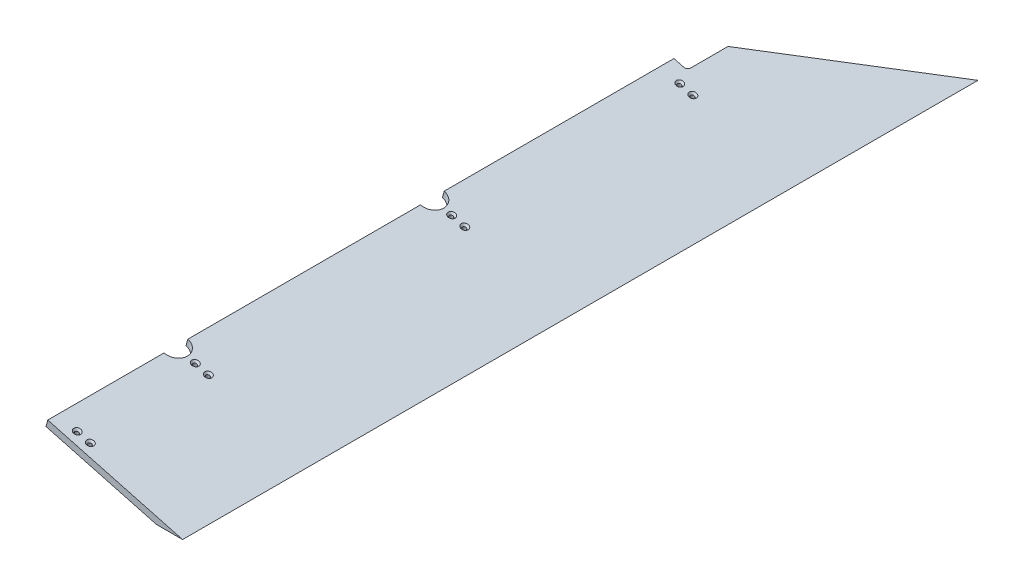
from build123d import *

# Parameters (mm, degrees)
BOSS_EXTRUDE1_DEPTH                                 = 1492.25
CSK_FOR_1_4_FLAT_HEAD_SOCKET_CAP_SCREW1_D           = 7.14248
CSK_FOR_1_4_FLAT_HEAD_SOCKET_CAP_SCREW1_CSINK_D     = 13.4874
CSK_FOR_1_4_FLAT_HEAD_SOCKET_CAP_SCREW1_CSINK_ANGLE = 82
SKETCH4_R                                           = 22.225
CUT_EXTRUDE1_DEPTH                                  = 1517.292738265
CUT_EXTRUDE2_DEPTH                                  = 1517.292738265
FILLET1_R                                           = 6.35


with BuildPart() as part:
    # Sketch1 → Boss-Extrude1 (new body)
    with BuildSketch(Plane.XY):
        Polygon((22.225, 55.50367642), (229.367540407, 0), (278.436572382, 0), (25.512001873, 67.770934414), align=None)
    extrude(amount=BOSS_EXTRUDE1_DEPTH)

    # CSK for 1/4 Flat Head Socket Cap Screw1 (through all)
    with Locations(Plane(origin=(18.651713678, 69.609143096, 0), x_dir=(0.9659258262890675, -0.2588190451025241, 0), z_dir=(0.2588190451025241, 0.9659258262890675, 0))):
        with Locations((44.668892959, -1251.74375), (70.068892959, -1251.74375), (44.668892959, -770.73125), (70.068892959, -770.73125), (44.668892959, -1473.2), (70.068892959, -1473.2), (44.668892959, -342.9), (70.068892959, -342.9)):
            CounterSinkHole(CSK_FOR_1_4_FLAT_HEAD_SOCKET_CAP_SCREW1_D / 2, CSK_FOR_1_4_FLAT_HEAD_SOCKET_CAP_SCREW1_CSINK_D / 2, counter_sink_angle=CSK_FOR_1_4_FLAT_HEAD_SOCKET_CAP_SCREW1_CSINK_ANGLE)

    # Sketch4 → Cut-Extrude1 (cut, through all)
    with BuildSketch(Plane(origin=(18.651713678, 69.609143096, 0), x_dir=(0.9659258262890675, -0.2588190451025241, 0), z_dir=(0.2588190451025241, 0.9659258262890675, 0))):
        with Locations((7.102292959, -770.73125)):
            Circle(SKETCH4_R)
        with Locations((7.102292959, -1251.74375)):
            Circle(SKETCH4_R)
    extrude(amount=-CUT_EXTRUDE1_DEPTH, mode=Mode.SUBTRACT)

    # Sketch5 → Cut-Extrude2 (cut, through all)
    with BuildSketch(Plane(origin=(18.651713678, 69.609143096, 0), x_dir=(0.9659258262890675, -0.2588190451025241, 0), z_dir=(0.2588190451025241, 0.9659258262890675, 0))):
        Polygon((7.102292959, -317.5), (7.102292959, 0), (268.949076248, 0), (32.502292959, -240.609994719), (32.502292959, -317.5), align=None)
    extrude(amount=-CUT_EXTRUDE2_DEPTH, mode=Mode.SUBTRACT)

    # Fillet1
    fillet1_edges = [part.edges().sort_by_distance(p)[0] for p in [
        (48.403016924, 55.063301672, 317.5),
    ]]
    fillet(fillet1_edges, radius=FILLET1_R)


solid = part.part
